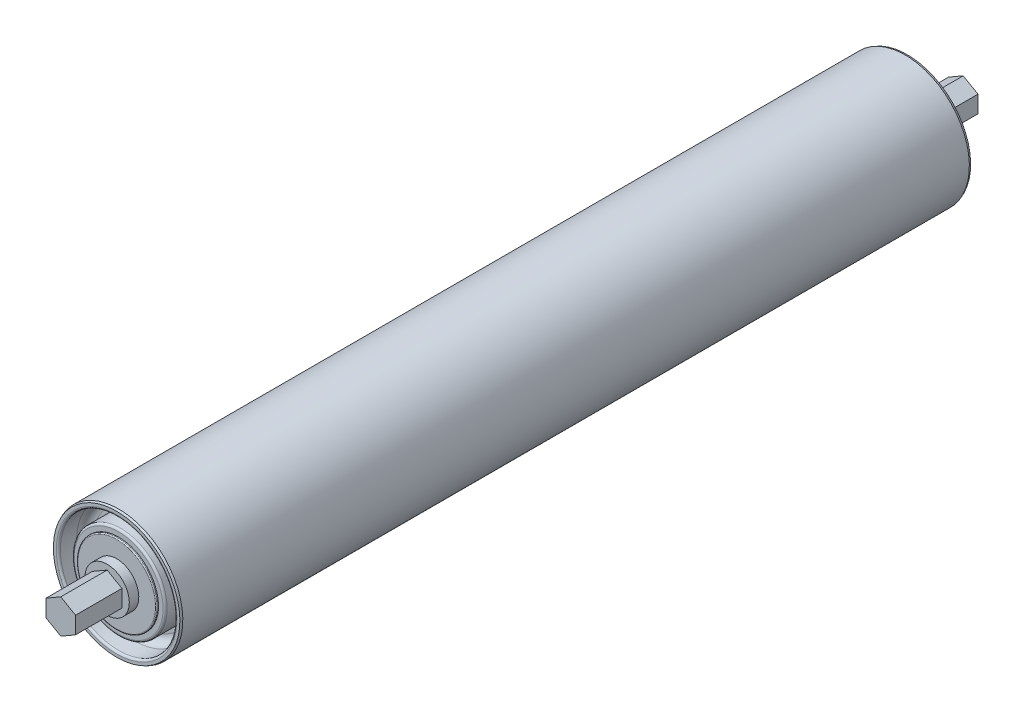
from build123d import *

# Parameters (mm, degrees)
BOSS_EXTRUDE1_REACH = 343.435


with BuildPart() as part:
    # Sketch3 → Revolve1 (revolve)
    with BuildSketch(Plane(origin=(0, 0, 0), x_dir=(0, 0, -1), z_dir=(1, 0, 0)), mode=Mode.PRIVATE) as revolve1_sk:
        Polygon((169.8625, 5.55625), (152.4, 5.55625), (152.4, 8.334375), (148.828125, 8.334375), (148.828125, 23.8125), (148.034375, 24.13), (-148.034375, 24.13), (-148.828125, 23.8125), (-148.828125, 8.334375), (-152.4, 8.334375), (-152.4, 5.55625), (-169.8625, 5.55625), (-169.8625, 0), (169.8625, 0), align=None)
    revolve(revolve1_sk.sketch.rotate(Axis((0, 0, 169.8625), (0, 0, -1)), 180), axis=Axis((0, 0, 169.8625), (0, 0, -1)))

    # Boss-Extrude1: up to this face of the body (flat: up to its plane)
    boss_extrude1_end = Plane(part.part.faces().sort_by_distance((0, 0, -169.8625))[0])
    # Sketch4 → Boss-Extrude1 (add, up to the picked face)
    with BuildSketch(Plane.XY.offset(169.8625), mode=Mode.PRIVATE) as boss_extrude1_sk1:
        Polygon((0, 6.415804866), (-5.55625, 3.207902433), (-5.55625, -3.207902433), (0, -6.415804866), (5.55625, -3.207902433), (5.55625, 3.207902433), align=None)
    boss_extrude1_tool1 = split(extrude(boss_extrude1_sk1.sketch, amount=-BOSS_EXTRUDE1_REACH, mode=Mode.PRIVATE), bisect_by=boss_extrude1_end, keep=Keep.BOTH, mode=Mode.PRIVATE)
    add(boss_extrude1_tool1.solids().sort_by(Axis((0, 0, 169.8625), (0, 0, -1)))[0])

    # Sketch6 → Cut-Revolve1 (revolve, cut)
    with BuildSketch(Plane(origin=(0, 0, 0), x_dir=(0, 0, -1), z_dir=(1, 0, 0)), mode=Mode.PRIVATE) as cut_revolve1_sk:
        with BuildLine():
            Line((-141.95425, 21.971), (-148.066125, 21.971))
            ThreePointArc((-148.066125, 21.971), (-148.604940367, 22.194184633), (-148.828125, 22.733))
            Line((-148.828125, 22.733), (-148.828125, 14.620875))
            ThreePointArc((-148.828125, 14.620875), (-148.716532684, 14.890282684), (-148.447125, 15.001875))
            Line((-148.447125, 15.001875), (-148.066125, 15.001875))
            Line((-148.066125, 15.001875), (-148.066125, 16.7401875))
            ThreePointArc((-148.066125, 16.7401875), (-147.842940367, 17.279002867), (-147.304125, 17.5021875))
            Line((-147.304125, 17.5021875), (-138.90625, 17.5021875))
            Line((-138.90625, 17.5021875), (-138.90625, 18.923))
            ThreePointArc((-138.90625, 18.923), (-139.798988531, 21.078261469), (-141.95425, 21.971))
        make_face()
    cut_revolve1 = revolve(cut_revolve1_sk.sketch.rotate(Axis((0, 0, 169.8625), (0, 0, -1)), 180), axis=Axis((0, 0, 169.8625), (0, 0, -1)), mode=Mode.SUBTRACT)

    # Mirror2: Cut-Revolve1 across plane
    add(cut_revolve1.mirror(Plane.XY), mode=Mode.SUBTRACT)


solid = part.part
